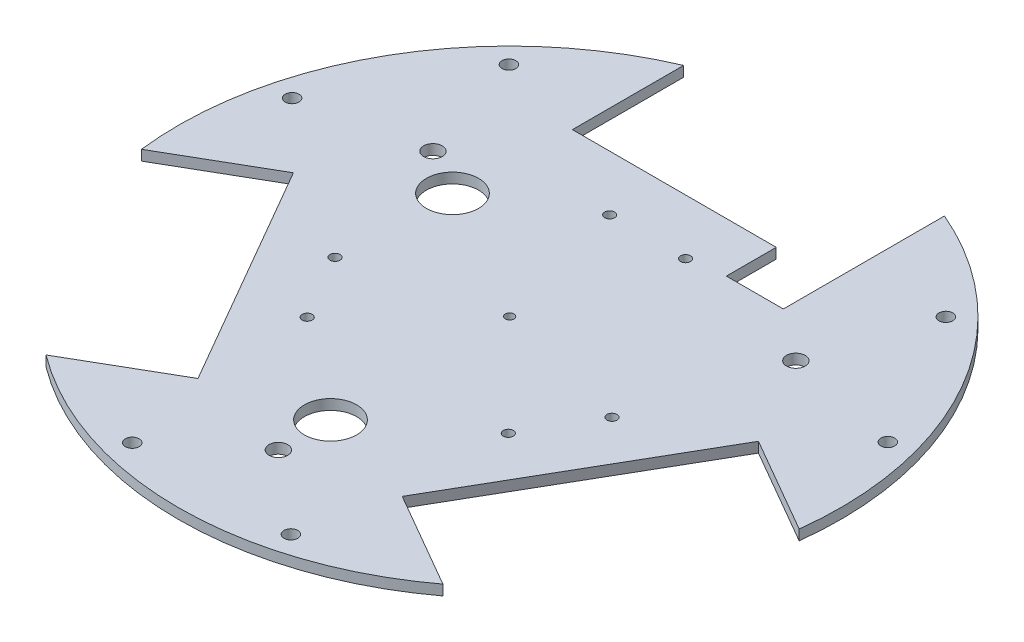
from build123d import *

# Parameters (mm, degrees)
SKETCH1_R           = 2.1463
BOSS_EXTRUDE1_DEPTH = 2.3622
SKETCH2_R           = 1.5875
CUT_EXTRUDE1_DEPTH  = 10
SKETCH4_R           = 6
SKETCH4_R_2         = 5.999999938
CUT_EXTRUDE3_DEPTH  = 10
SKETCH6_R           = 1
CUT_EXTRUDE4_DEPTH  = 10
CIRPATTERN2_COUNT   = 3
SKETCH7_R           = 1.14935
CUT_EXTRUDE5_DEPTH  = 2.54
CIRPATTERN3_COUNT   = 3
SKETCH8_W           = 13.106463283
SKETCH8_H           = 11.477303128
CUT_EXTRUDE6_DEPTH  = 2.54


with BuildPart() as part:
    # Sketch1 → Boss-Extrude1 (new body)
    with BuildSketch(Plane(origin=(0, 0, 0), x_dir=(1, 0, 0), z_dir=(0, 1, 0))):
        with BuildLine():
            Line((-30, 44.45), (-30, 70.045984896))
            ThreePointArc((-30, 70.045984896), (-65.991135768, 38.1), (-75.661602353, -9.042230334))
            Line((-75.661602353, -9.042230334), (-53.494829198, 3.755762114))
            Line((-53.494829198, 3.755762114), (-23.494829198, -48.205762114))
            Line((-23.494829198, -48.205762114), (-45.661602353, -61.003754561))
            ThreePointArc((-45.661602353, -61.003754561), (0, -76.2), (45.661602353, -61.003754561))
            Line((45.661602353, -61.003754561), (23.494829198, -48.205762114))
            Line((23.494829198, -48.205762114), (53.494829198, 3.755762114))
            Line((53.494829198, 3.755762114), (75.661602353, -9.042230334))
            ThreePointArc((75.661602353, -9.042230334), (65.991135768, 38.1), (30, 70.045984896))
            Line((30, 70.045984896), (30, 44.45))
            Line((30, 44.45), (-30, 44.45))
        make_face()
        with Locations(Location((-41.747414599, 24.102881057, 0), (0, 0, 270))):
            Circle(SKETCH1_R, mode=Mode.SUBTRACT)
        with Locations(Location((41.747414599, 24.102881057, 0), (0, 0, 270))):
            Circle(SKETCH1_R, mode=Mode.SUBTRACT)
        with Locations(Location((0, -53.205762114, 0), (0, 0, 90))):
            Circle(SKETCH1_R, mode=Mode.SUBTRACT)
    extrude(amount=BOSS_EXTRUDE1_DEPTH)

    # Sketch2 → Cut-Extrude1 (cut)
    with BuildSketch(Plane(origin=(0, 2.3622, 0), x_dir=(1, 0, 0), z_dir=(0, 1, 0))):
        with Locations(Location((18.25625, -68.58, 0), (0, 0, 270))):
            Circle(SKETCH2_R)
        with Locations(Location((-18.25625, -68.58, 0), (0, 0, 270))):
            Circle(SKETCH2_R)
    cut_extrude1 = extrude(amount=-CUT_EXTRUDE1_DEPTH, mode=Mode.SUBTRACT)

    # Sketch4 → Cut-Extrude3 (cut)
    with BuildSketch(Plane(origin=(0, 2.3622, 0), x_dir=(1, 0, 0), z_dir=(0, 1, 0))):
        with Locations(Location((0, -41.205762114, 0), (0, 0, 270))):
            Circle(SKETCH4_R)
        with Locations(Location((-31.095337868, 17.952901689, 0), (0, 0, 270))):
            Circle(SKETCH4_R_2)
    extrude(amount=-CUT_EXTRUDE3_DEPTH, mode=Mode.SUBTRACT)

    # Sketch6 → Cut-Extrude4 (cut)
    with BuildSketch(Plane.XZ):
        with Locations(Location((0, 0, 0), (0, 0, 270))):
            Circle(SKETCH6_R)
    extrude(amount=-CUT_EXTRUDE4_DEPTH, mode=Mode.SUBTRACT)

    # CirPattern2: Cut-Extrude1 ×3 about axis
    cirpattern2_axis = Axis((0, 0, 0), (0, 1, 0))
    for i in range(1, CIRPATTERN2_COUNT):
        add(cut_extrude1.rotate(cirpattern2_axis, i * 360 / CIRPATTERN2_COUNT), mode=Mode.SUBTRACT)

    # Sketch7 → Cut-Extrude5 (cut)
    with BuildSketch(Plane.XZ):
        with Locations(Location((8.73125, -31.75, 0), (0, 0, 270))):
            Circle(SKETCH7_R)
        with Locations(Location((-8.73125, -31.75, 0), (0, 0, 270))):
            Circle(SKETCH7_R)
    cut_extrude5 = extrude(amount=-CUT_EXTRUDE5_DEPTH, mode=Mode.SUBTRACT)

    # CirPattern3: Cut-Extrude5 ×3 about axis
    cirpattern3_axis = Axis((0, 0, 0), (0, 1, 0))
    for i in range(1, CIRPATTERN3_COUNT):
        add(cut_extrude5.rotate(cirpattern3_axis, i * 360 / CIRPATTERN3_COUNT), mode=Mode.SUBTRACT)

    # Sketch8 → Cut-Extrude6 (cut)
    with BuildSketch(Plane(origin=(0, 2.3622, 0), x_dir=(1, 0, 0), z_dir=(0, 1, 0))):
        with Locations((23.446768359, 38.711348436)):
            Rectangle(SKETCH8_W, SKETCH8_H)
    extrude(amount=-CUT_EXTRUDE6_DEPTH, mode=Mode.SUBTRACT)


solid = part.part
